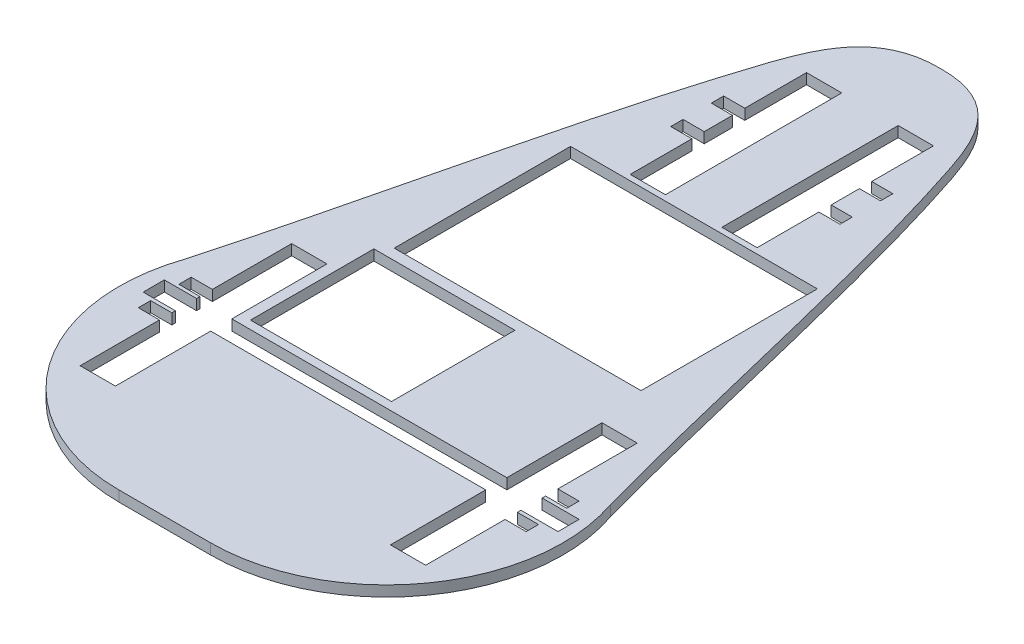
from build123d import *

# Parameters (mm, degrees)
BOSS_EXTRUDE1_DEPTH = 3


with BuildPart() as part:
    # Sketch1 → Boss-Extrude1 (new body)
    # profile 1 of 2: a face of its own
    with BuildSketch(Plane(origin=(0, 0, 0), x_dir=(1, 0, 0), z_dir=(0, 1, 0))):
        with BuildLine():
            add(Edge.make_bspline(
                [(54.921096163, 210.717166197), (55.81137082, 210.717166197), (73.117417783, 210.307734869), (83.16859041, 181.782071598), (97.327576281, 130.307148929), (107.260265849, 85.588568729), (115.245027355, 56.779327706)],
                knots=[0, 0, 0, 0, 0.011068306, 0.221366129, 0.459883163, 1, 1, 1, 1], degree=3))
            Line((54.921096163, 210.717166197), (54.921096163, 139.134229743))
            Line((54.921096163, 139.134229743), (91.576602309, 139.134229743))
            Line((91.576602309, 139.134229743), (91.576602309, 89.134229743))
            Line((91.576602309, 89.134229743), (54.921096163, 89.134229743))
            Line((54.921096163, 89.134229743), (54.921096163, 86.082402682))
            Line((54.921096163, 86.082402682), (58.870747079, 86.082402682))
            Line((58.870747079, 86.082402682), (58.870747079, 51.082402682))
            Line((58.870747079, 51.082402682), (54.921096163, 51.082402682))
            Line((54.921096163, 51.082402682), (54.921096163, 48.736405384))
            Line((54.921096163, 48.736405384), (93.921096163, 48.736405384))
            Line((93.921096163, 48.736405384), (93.921096163, 75.717166197))
            Line((93.921096163, 75.717166197), (103.921096163, 75.717166197))
            Line((103.921096163, 75.717166197), (103.921096163, 53.217166197))
            Line((103.921096163, 53.217166197), (109.921096163, 53.217166197))
            Line((109.921096163, 53.217166197), (109.921096163, 49.717166197))
            Line((109.921096163, 49.717166197), (103.921096163, 49.717166197))
            Line((103.921096163, 49.717166197), (103.921096163, 48.736405384))
            Line((103.921096163, 48.736405384), (114.420720505, 48.736405384))
            Line((114.420720505, 48.736405384), (114.420720505, 42.736405384))
            Line((114.420720505, 42.736405384), (103.921096163, 42.736405384))
            Line((103.921096163, 42.736405384), (103.921096163, 41.717166197))
            Line((103.921096163, 41.717166197), (109.921096163, 41.717166197))
            Line((109.921096163, 41.717166197), (109.921096163, 38.217166197))
            Line((109.921096163, 38.217166197), (103.921096163, 38.217166197))
            Line((103.921096163, 38.217166197), (103.921096163, 15.717166197))
            Line((103.921096163, 15.717166197), (93.921096163, 15.717166197))
            Line((93.921096163, 15.717166197), (93.921096163, 42.736405384))
            Line((93.921096163, 42.736405384), (54.921096163, 42.736405384))
            Line((54.921096163, 42.736405384), (54.921096163, -9.282833803))
            Line((54.921096163, -9.282833803), (64.921096163, -9.282833803))
            Line((64.921096163, -9.282833803), (67.895191372, -9.282833803))
            ThreePointArc((67.895191372, -9.282833803), (108.534507775, 11.589070443), (115.245027355, 56.779327706))
        make_face()
        Polygon((72.921096163, 161.717166197), (78.921096163, 161.717166197), (78.921096163, 158.217166197), (72.921096163, 158.217166197), (72.921096163, 140.717166197), (62.921096163, 140.717166197), (62.921096163, 190.717166197), (72.921096163, 190.717166197), (72.921096163, 173.217166197), (78.921096163, 173.217166197), (78.921096163, 169.717166197), (72.921096163, 169.717166197), align=None, mode=Mode.SUBTRACT)
    # profile 2 of 2: a face of its own
    with BuildSketch(Plane(origin=(0, 0, 0), x_dir=(1, 0, 0), z_dir=(0, 1, 0))):
        with BuildLine():
            Line((54.921096163, 139.134229743), (54.921096163, 210.717166197))
            add(Edge.make_bspline(
                [(54.921096163, 210.717166197), (54.030821506, 210.717166197), (36.724774544, 210.307734869), (26.673601916, 181.782071598), (12.514616045, 130.307148929), (2.581926477, 85.588568729), (-5.402835029, 56.779327706)],
                knots=[0, 0, 0, 0, 0.011068306, 0.221366129, 0.459883163, 1, 1, 1, 1], degree=3))
            ThreePointArc((-5.402835029, 56.779327706), (1.307684551, 11.589070443), (41.947000955, -9.282833803))
            Line((41.947000955, -9.282833803), (44.921096163, -9.282833803))
            Line((44.921096163, -9.282833803), (54.921096163, -9.282833803))
            Line((54.921096163, -9.282833803), (54.921096163, 42.736405384))
            Line((54.921096163, 42.736405384), (15.921096163, 42.736405384))
            Line((15.921096163, 42.736405384), (15.921096163, 15.717166197))
            Line((15.921096163, 15.717166197), (5.921096163, 15.717166197))
            Line((5.921096163, 15.717166197), (5.921096163, 38.217166197))
            Line((5.921096163, 38.217166197), (-0.078903837, 38.217166197))
            Line((-0.078903837, 38.217166197), (-0.078903837, 41.717166197))
            Line((-0.078903837, 41.717166197), (5.921096163, 41.717166197))
            Line((5.921096163, 41.717166197), (5.921096163, 42.736405384))
            Line((5.921096163, 42.736405384), (-3.221531429, 42.736405384))
            Line((-3.221531429, 42.736405384), (-3.221531429, 48.736405384))
            Line((-3.221531429, 48.736405384), (5.921096163, 48.736405384))
            Line((5.921096163, 48.736405384), (5.921096163, 49.717166197))
            Line((5.921096163, 49.717166197), (-0.078903837, 49.717166197))
            Line((-0.078903837, 49.717166197), (-0.078903837, 53.217166197))
            Line((-0.078903837, 53.217166197), (5.921096163, 53.217166197))
            Line((5.921096163, 53.217166197), (5.921096163, 75.717166197))
            Line((5.921096163, 75.717166197), (15.921096163, 75.717166197))
            Line((15.921096163, 75.717166197), (15.921096163, 48.736405384))
            Line((15.921096163, 48.736405384), (54.921096163, 48.736405384))
            Line((54.921096163, 48.736405384), (54.921096163, 51.082402682))
            Line((54.921096163, 51.082402682), (18.870747079, 51.082402682))
            Line((18.870747079, 51.082402682), (18.870747079, 86.082402682))
            Line((18.870747079, 86.082402682), (54.921096163, 86.082402682))
            Line((54.921096163, 86.082402682), (54.921096163, 89.134229743))
            Line((54.921096163, 89.134229743), (21.576602309, 89.134229743))
            Line((21.576602309, 89.134229743), (21.576602309, 139.134229743))
            Line((21.576602309, 139.134229743), (54.921096163, 139.134229743))
        make_face()
        Polygon((30.921096163, 169.717166197), (30.921096163, 173.217166197), (36.921096163, 173.217166197), (36.921096163, 190.717166197), (46.921096163, 190.717166197), (46.921096163, 140.717166197), (36.921096163, 140.717166197), (36.921096163, 158.217166197), (30.921096163, 158.217166197), (30.921096163, 161.717166197), (36.921096163, 161.717166197), (36.921096163, 169.717166197), align=None, mode=Mode.SUBTRACT)
    extrude(amount=BOSS_EXTRUDE1_DEPTH)


solid = part.part
